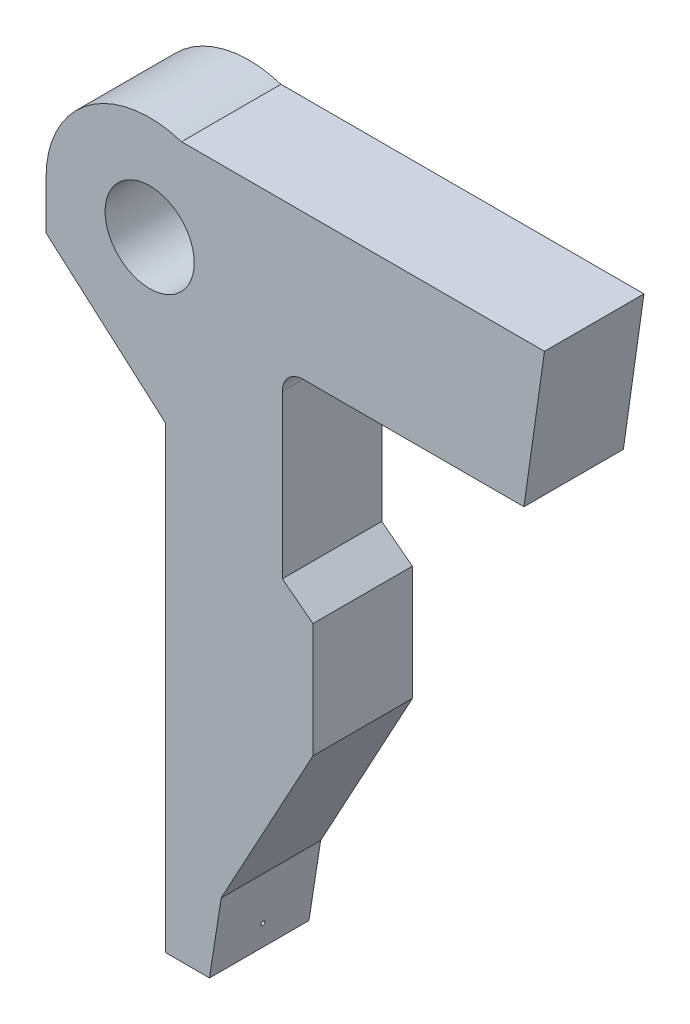
from build123d import *

# Parameters (mm, degrees)
SKETCH_1_R          = 5
SKETCH_1_R_2        = 2.15
EXTRUDE_1_DEPTH     = 4.8
SKETCH_3_R          = 1.825
CUT_EXTRUDE_1_DEPTH = 1.8
CUT_EXTRUDE_2_REACH = 36.158
SKETCH_4_R          = 0.1


with BuildPart() as part:
    # 스케치1 → 보스-돌출1 (new body)
    # profile 1 of 2: a face of its own
    with BuildSketch(Plane.XY):
        with BuildLine():
            ThreePointArc((5, 0), (0, -5), (-5, 0))
            Line((-5, 0), (-5, -2.326474397))
            Line((-5, -2.326474397), (0.754164722, -7.377840375))
            Line((0.754164722, -7.377840375), (0.754164722, -29.519890116))
            Line((0.754164722, -29.519890116), (2.889052882, -29.519890116))
            Line((2.889052882, -29.519890116), (3.452626944, -25.890848407))
            Line((3.452626944, -25.890848407), (7.880357437, -17.740939791))
            Line((7.880357437, -17.740939791), (7.880357437, -12.211059606))
            Line((7.880357437, -12.211059606), (6.40208237, -11.079255258))
            Line((6.40208237, -11.079255258), (6.40208237, -3.237610212))
            ThreePointArc((6.40208237, -3.237610212), (6.694975589, -2.530503431), (7.40208237, -2.237610212))
            Line((7.40208237, -2.237610212), (18.063612226, -2.237610212))
            Line((18.063612226, -2.237610212), (19.056002599, 4.757997197))
            Line((19.056002599, 4.757997197), (1.536705134, 4.757997197))
            ThreePointArc((1.536705134, 4.757997197), (4.04249463, 2.942488261), (5, 0))
        make_face()
    # profile 2 of 2: a face of its own
    with BuildSketch(Plane.XY):
        Circle(SKETCH_1_R)
        Circle(SKETCH_1_R_2, mode=Mode.SUBTRACT)
    extrude(amount=EXTRUDE_1_DEPTH)

    # 스케치3 → 컷-돌출1 (cut)
    with BuildSketch(Plane.ZY.offset(-0.754164722)):
        with Locations((2.4, -27.019890116)):
            Circle(SKETCH_3_R)
    extrude(amount=-CUT_EXTRUDE_1_DEPTH, mode=Mode.SUBTRACT)

    # 컷-돌출2: up to this plane
    cut_extrude_2_end = Plane(origin=(7.297372122, -1.133249487, 4.8), z_dir=(-0.9881554576984991, 0.15345615471746255, 0))
    # 스케치4 → 컷-돌출2 (cut, up to the surface)
    with BuildSketch(Plane.ZY.offset(-2.554164722), mode=Mode.PRIVATE) as cut_extrude_2_sk1:
        with Locations((2.4, -28.344890116)):
            Circle(SKETCH_4_R)
    cut_extrude_2_tool1 = split(extrude(cut_extrude_2_sk1.sketch, amount=-CUT_EXTRUDE_2_REACH, mode=Mode.PRIVATE), bisect_by=cut_extrude_2_end, keep=Keep.BOTH, mode=Mode.PRIVATE)
    add(cut_extrude_2_tool1.solids().sort_by_distance((2.554165, -28.34489, 2.4))[0], mode=Mode.SUBTRACT)


solid = part.part
